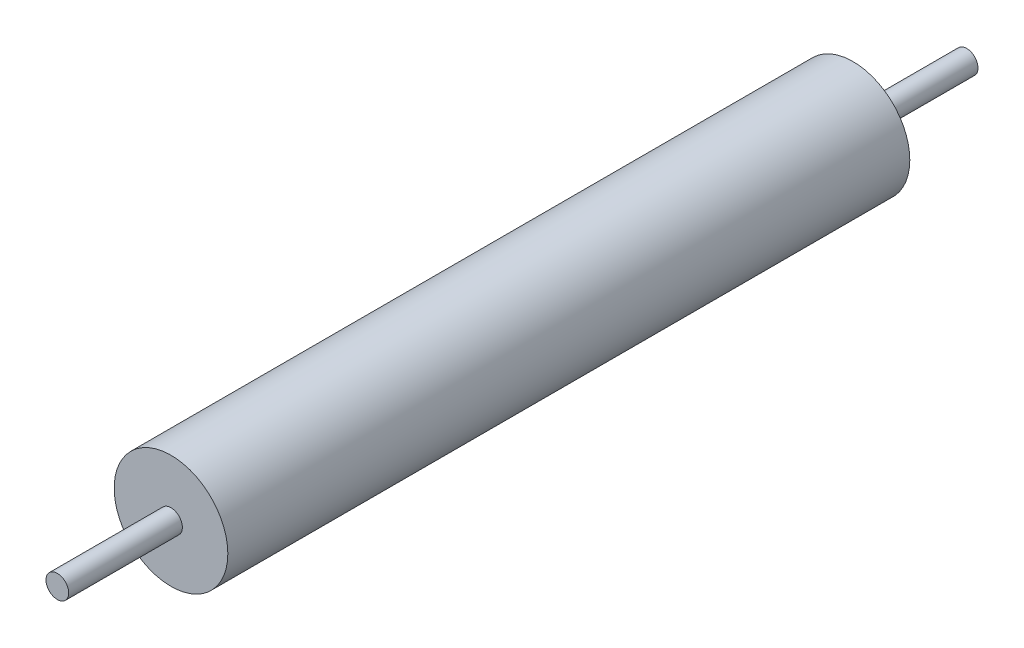
from build123d import *

# Parameters (mm, degrees)
SKETCH_1_R      = 2.5
EXTRUDE_1_DEPTH = 100
SKETCH_3_R      = 12.5
EXTRUDE_2_DEPTH = 75


with BuildPart() as part:
    # 草图1 → 凸台-拉伸1 (new, symmetric)
    with BuildSketch(Plane.XY):
        Circle(SKETCH_1_R)
    extrude(amount=EXTRUDE_1_DEPTH, both=True)

    # 草图3 → 凸台-拉伸2 (add, symmetric)
    with BuildSketch(Plane.XY):
        Circle(SKETCH_3_R)
    extrude(amount=EXTRUDE_2_DEPTH, both=True)


solid = part.part
